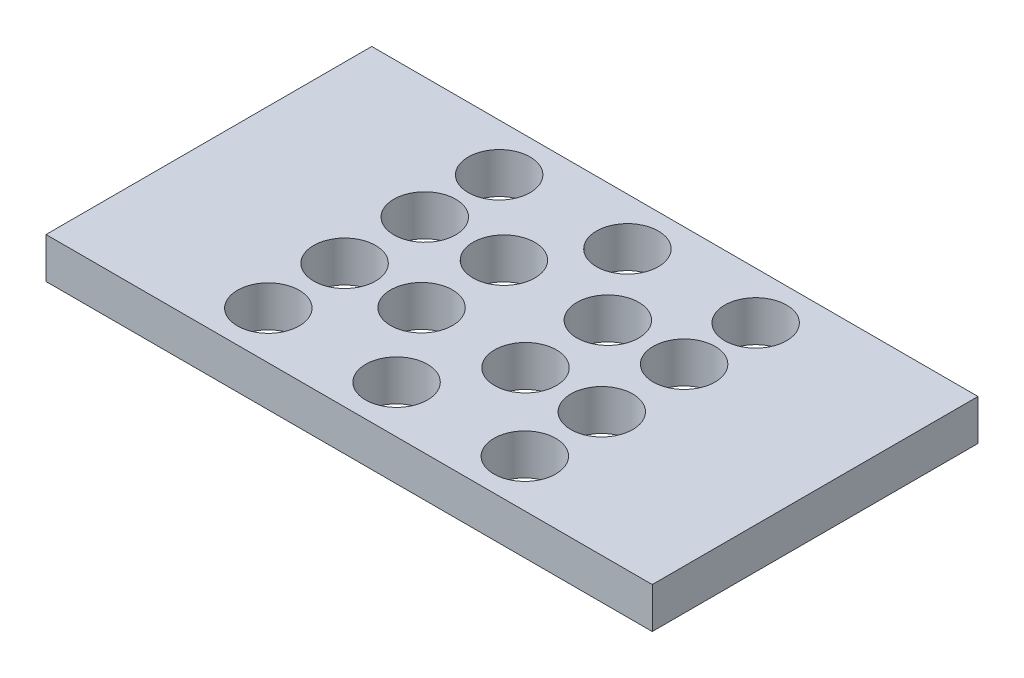
from build123d import *

# Parameters (mm, degrees)
SKETCH1_W           = 94.54485576
SKETCH1_H           = 50.8
SKETCH1_R           = 4.825
BOSS_EXTRUDE1_DEPTH = 6.35


with BuildPart() as part:
    # Sketch1 → Boss-Extrude1 (new body)
    with BuildSketch(Plane(origin=(0, 0, 0), x_dir=(1, 0, 0), z_dir=(0, 1, 0))):
        Rectangle(SKETCH1_W, SKETCH1_H)
        with Locations(Location((0, 18, 0), (0, 0, 270))):
            Circle(SKETCH1_R, mode=Mode.SUBTRACT)
        with Locations(Location((0, -18, 0), (0, 0, 270))):
            Circle(SKETCH1_R, mode=Mode.SUBTRACT)
        with Locations(Location((20, 18, 0), (0, 0, 270))):
            Circle(SKETCH1_R, mode=Mode.SUBTRACT)
        with Locations(Location((20, 6.844021817, 0), (0, 0, 270))):
            Circle(SKETCH1_R, mode=Mode.SUBTRACT)
        with Locations(Location((20, -6, 0), (0, 0, 270))):
            Circle(SKETCH1_R, mode=Mode.SUBTRACT)
        with Locations(Location((20, -18, 0), (0, 0, 270))):
            Circle(SKETCH1_R, mode=Mode.SUBTRACT)
        with Locations(Location((-20, 18, 0), (0, 0, 270))):
            Circle(SKETCH1_R, mode=Mode.SUBTRACT)
        with Locations(Location((-20.099500439, 6.496836504, 0), (0, 0, 270))):
            Circle(SKETCH1_R, mode=Mode.SUBTRACT)
        with Locations(Location((-20.104523892, -6, 0), (0, 0, 270))):
            Circle(SKETCH1_R, mode=Mode.SUBTRACT)
        with Locations(Location((-20, -18, 0), (0, 0, 270))):
            Circle(SKETCH1_R, mode=Mode.SUBTRACT)
        with Locations(Location((-8.104523892, 6.844021817, 0), (0, 0, 270))):
            Circle(SKETCH1_R, mode=Mode.SUBTRACT)
        with Locations(Location((-8.104523892, -6, 0), (0, 0, 270))):
            Circle(SKETCH1_R, mode=Mode.SUBTRACT)
        with Locations(Location((8.104523892, 6.844021817, 0), (0, 0, 270))):
            Circle(SKETCH1_R, mode=Mode.SUBTRACT)
        with Locations(Location((8.104523892, -6, 0), (0, 0, 270))):
            Circle(SKETCH1_R, mode=Mode.SUBTRACT)
    extrude(amount=BOSS_EXTRUDE1_DEPTH)


solid = part.part
